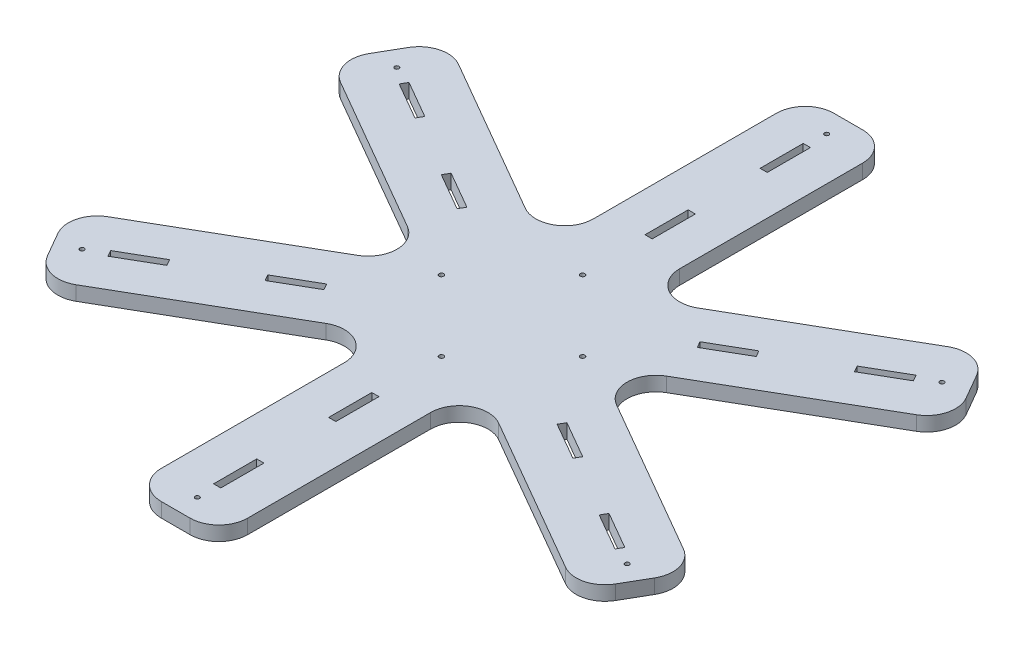
from build123d import *

# Parameters (mm, degrees)
SKETCH_2_W          = 46
SKETCH_2_H          = 46
EXTRUDE_1_DEPTH     = 10
SKETCH_4_R          = 55
SKETCH_4_R_2        = 1.6
EXTRUDE_2_DEPTH     = 10
SKETCH_5_R          = 55
EXTRUDE_3_DEPTH     = 10
SKETCH_6_R          = 1.5
SKETCH_6_W          = 5
SKETCH_6_H          = 30
CUT_EXTRUDE_1_DEPTH = 320.501564941
FILLET_1_R          = 20


with BuildPart() as part:
    # 草图2 → 凸台-拉伸1 (new body)
    with BuildSketch(Plane(origin=(0, 0, 0), x_dir=(1, 0, 0), z_dir=(0, 1, 0))):
        Rectangle(SKETCH_2_W, SKETCH_2_H)
    extrude(amount=EXTRUDE_1_DEPTH)

    # 草图4 → 凸台-拉伸2 (add)
    with BuildSketch(Plane(origin=(0, 10, 0), x_dir=(1, 0, 0), z_dir=(0, 1, 0))):
        with Locations(Location((0, 0, 0), (0, 0, 270))):
            Circle(SKETCH_4_R)
        with Locations(Location((-49.1, 0, 0), (0, 0, 270))):
            Circle(SKETCH_4_R_2, mode=Mode.SUBTRACT)
        with Locations(Location((0, -49.1, 0), (0, 0, 270))):
            Circle(SKETCH_4_R_2, mode=Mode.SUBTRACT)
        with Locations(Location((49.1, 0, 0), (0, 0, 270))):
            Circle(SKETCH_4_R_2, mode=Mode.SUBTRACT)
        with Locations(Location((0, 49.1, 0), (0, 0, 270))):
            Circle(SKETCH_4_R_2, mode=Mode.SUBTRACT)
    extrude(amount=-EXTRUDE_2_DEPTH)

    # 草图5 → 凸台-拉伸3 (add)
    with BuildSketch(Plane(origin=(0, 10, 0), x_dir=(1, 0, 0), z_dir=(0, 1, 0))):
        Polygon((30, -233.826859022), (30, -51.961524227), (187.5, -142.894191624), (217.5, -90.932667397), (60, 0), (217.5, 90.932667397), (187.5, 142.894191624), (30, 51.961524227), (30, 233.826859022), (-30, 233.826859022), (-30, 51.961524227), (-187.5, 142.894191624), (-217.5, 90.932667397), (-60, 0), (-217.5, -90.932667397), (-187.5, -142.894191624), (-30, -51.961524227), (-30, -233.826859022), align=None)
        Circle(SKETCH_5_R, mode=Mode.SUBTRACT)
    extrude(amount=-EXTRUDE_3_DEPTH)

    # 草图6 → 切除-拉伸1 (cut, through all)
    with BuildSketch(Plane(origin=(0, 10, 0), x_dir=(1, 0, 0), z_dir=(0, 1, 0))):
        with Locations(Location((0, 218.826859022, 0), (0, 0, 270))):
            Circle(SKETCH_6_R)
        with Locations(Location((189.509618943, 109.413429511, 0), (0, 0, 270))):
            Circle(SKETCH_6_R)
        with Locations(Location((189.509618943, -109.413429511, 0), (0, 0, 270))):
            Circle(SKETCH_6_R)
        with Locations(Location((0, -218.826859022, 0), (0, 0, 270))):
            Circle(SKETCH_6_R)
        with Locations(Location((-189.509618943, -109.413429511, 0), (0, 0, 270))):
            Circle(SKETCH_6_R)
        with Locations(Location((-189.509618943, 109.413429511, 0), (0, 0, 270))):
            Circle(SKETCH_6_R)
        Polygon((152.804445662, 85.334936491), (150.304445662, 89.665063509), (176.285207776, 104.665063509), (178.785207776, 100.334936491), align=None)
        with Locations((0, 190)):
            Rectangle(SKETCH_6_W, SKETCH_6_H)
        with Locations((0, 110)):
            Rectangle(SKETCH_6_W, SKETCH_6_H)
        Polygon((83.52241336, 45.334936491), (81.02241336, 49.665063509), (107.003175473, 64.665063509), (109.503175473, 60.334936491), align=None)
        Polygon((-107.003175473, -64.665063509), (-109.503175473, -60.334936491), (-83.52241336, -45.334936491), (-81.02241336, -49.665063509), align=None)
        Polygon((81.02241336, -49.665063509), (83.52241336, -45.334936491), (109.503175473, -60.334936491), (107.003175473, -64.665063509), align=None)
        Polygon((-109.503175473, 60.334936491), (-107.003175473, 64.665063509), (-81.02241336, 49.665063509), (-83.52241336, 45.334936491), align=None)
        Polygon((-176.285207776, -104.665063509), (-178.785207776, -100.334936491), (-152.804445662, -85.334936491), (-150.304445662, -89.665063509), align=None)
        Polygon((150.304445662, -89.665063509), (152.804445662, -85.334936491), (178.785207776, -100.334936491), (176.285207776, -104.665063509), align=None)
        Polygon((-178.785207776, 100.334936491), (-176.285207776, 104.665063509), (-150.304445662, 89.665063509), (-152.804445662, 85.334936491), align=None)
        with Locations((0, -110)):
            Rectangle(SKETCH_6_W, SKETCH_6_H)
        with Locations((0, -190)):
            Rectangle(SKETCH_6_W, SKETCH_6_H)
    extrude(amount=-CUT_EXTRUDE_1_DEPTH, mode=Mode.SUBTRACT)

    # 圆角1
    fillet_1_edges = [part.edges().sort_by_distance(p)[0] for p in [
        (187.5, 5, -142.894191624),
        (217.5, 5, -90.932667397),
        (60, 5, 0),
        (217.5, 5, 90.932667397),
        (187.5, 5, 142.894191624),
        (30, 5, 51.961524227),
        (30, 5, 233.826859022),
        (-30, 5, 233.826859022),
        (-30, 5, 51.961524227),
        (-187.5, 5, 142.894191624),
        (-217.5, 5, 90.932667397),
        (-60, 5, 0),
        (-217.5, 5, -90.932667397),
        (-187.5, 5, -142.894191624),
        (-30, 5, -51.961524227),
        (-30, 5, -233.826859022),
        (30, 5, -233.826859022),
        (30, 5, -51.961524227),
    ]]
    fillet(fillet_1_edges, radius=FILLET_1_R)


solid = part.part
